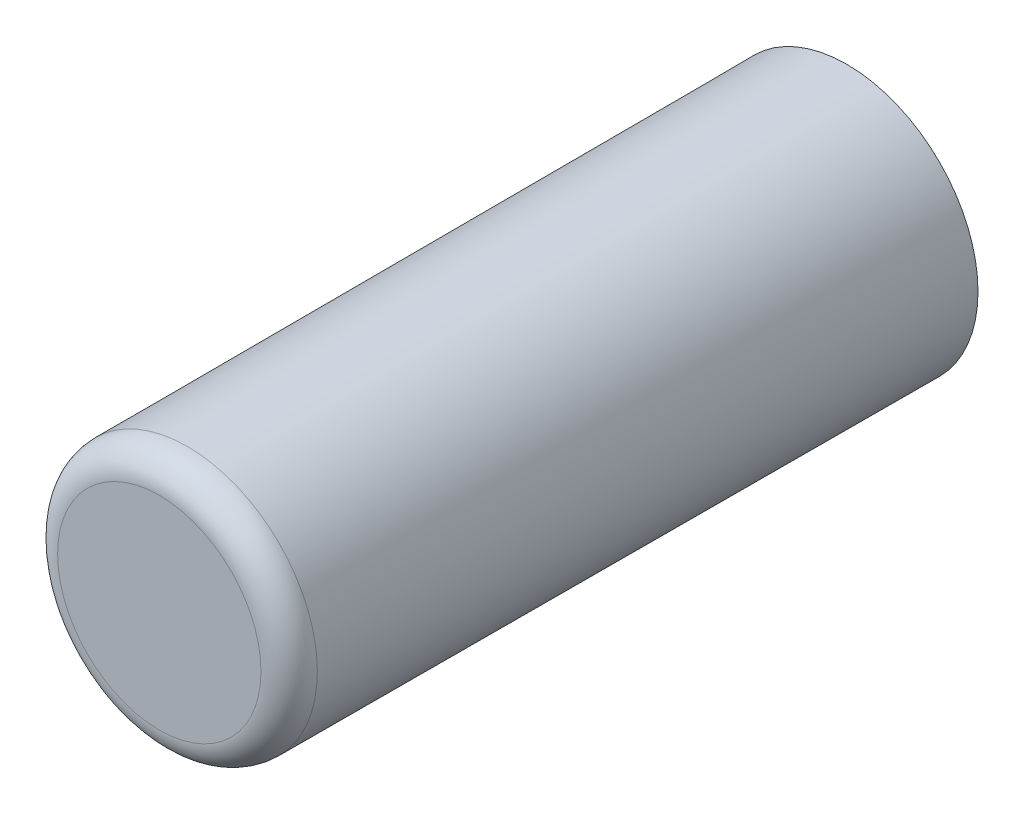
from build123d import *

# Parameters (mm, degrees)
SKETCH2_R = 0.889
FILLET1_R = 2


with BuildPart() as part:
    # Sketch1 → Revolve1 (revolve)
    with BuildSketch(Plane(origin=(0, 0, 0), x_dir=(1, 0, 0), z_dir=(0, 1, 0)), mode=Mode.PRIVATE) as revolve1_sk:
        Polygon((0, -48.768), (9.2075, -48.768), (9.30275, 0), (8.382, 0), (8.382, -1.27), (6.604, -1.27), (6.604, 0), (2.8067, 0), (2.8067, -4.572), (0, -4.572), align=None)
    revolve(revolve1_sk.sketch.rotate(Axis((0, 0, 0), (0, 0, 1)), 180), axis=Axis((0, 0, 0), (0, 0, 1)))

    # Fillet1
    fillet1_edges = [part.edges().sort_by_distance(p)[0] for p in [
        (9.2075, 0, 48.768),
    ]]
    fillet(fillet1_edges, radius=FILLET1_R)


with BuildPart() as body_2:
    # Sketch2 → Revolve2 (revolve)
    with BuildSketch(Plane(origin=(0, 0, 0), x_dir=(0, 0, -1), z_dir=(1, 0, 0)), mode=Mode.PRIVATE) as revolve2_sk:
        with Locations((-0.381, 7.493)):
            Circle(SKETCH2_R)
    revolve(revolve2_sk.sketch.rotate(Axis((0, 0, 0), (0, 0, 1)), 90), axis=Axis((0, 0, 0), (0, 0, 1)))


solid = Compound([part.part, body_2.part])
